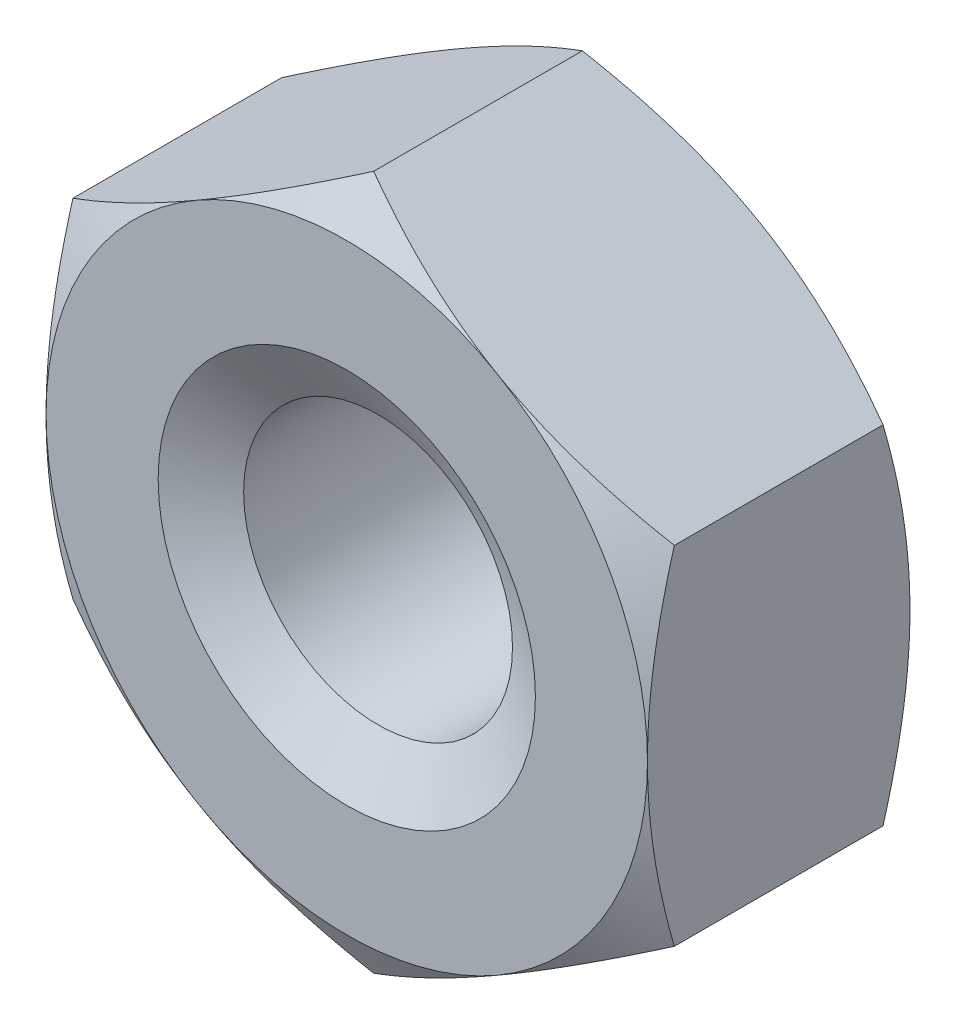
from build123d import *

# Parameters (mm, degrees)
SKETCH_3_R          = 1.229375
EXTRUDE_1_DEPTH     = 2.4
SKETCH_5_R          = 4.5075
SKETCH_5_R_2        = 2.75
CUT_EXTRUDE_1_DEPTH = 0.48
CUT_EXTRUDE_1_DRAFT = -60
SKETCH_7_R          = 4.5075
SKETCH_7_R_2        = 2.75
CUT_EXTRUDE_2_DEPTH = 0.48
CUT_EXTRUDE_2_DRAFT = -60


with BuildPart() as part:
    # 草图3 → 凸台-拉伸1 (new body)
    with BuildSketch(Plane.XY):
        Polygon((0, 3.175426481), (-2.75, 1.58771324), (-2.75, -1.58771324), (0, -3.175426481), (2.75, -1.58771324), (2.75, 1.58771324), align=None)
        Circle(SKETCH_3_R, mode=Mode.SUBTRACT)
    extrude(amount=-EXTRUDE_1_DEPTH)

    # 草图4 → 切除-旋转1 (revolve, cut)
    with BuildSketch(Plane(origin=(0, 0, 0), x_dir=(0, 0, -1), z_dir=(1, 0, 0)), mode=Mode.PRIVATE) as cut_revolve_1_sk:
        Polygon((0, 1.725), (0.286149227, 1.229375), (0.286149227, 0), (0, 0), align=None)
        Polygon((2.4, 0), (2.4, 1.725), (2.113850773, 1.229375), (2.113850773, 0), align=None)
    revolve(cut_revolve_1_sk.sketch.rotate(Axis((0, 0, 0), (0, 0, -1)), 90), axis=Axis((0, 0, 0), (0, 0, -1)), mode=Mode.SUBTRACT)


with BuildPart() as cut_extrude_1_tool:
    # 草图5 → 切除-拉伸1 (with draft: the straight prism first)
    with BuildSketch(Plane.XY):
        Circle(SKETCH_5_R)
        Circle(SKETCH_5_R_2, mode=Mode.SUBTRACT)
    extrude(amount=-CUT_EXTRUDE_1_DEPTH)
    # 切除-拉伸1: the draft: its side faces are tilted about the plane it starts from
    cut_extrude_1_sides = [cut_extrude_1_tool.faces().sort_by_distance(p)[0] for p in [
        (-4.5075, 0, -0.24),
        (-2.75, 0, -0.24),
    ]]
    draft(cut_extrude_1_sides, Plane.XY, CUT_EXTRUDE_1_DRAFT)


with BuildPart() as part_1:
    add(part.part)

    # 切除-拉伸1: cut by cut_extrude_1_tool
    add(cut_extrude_1_tool.part, mode=Mode.SUBTRACT)


with BuildPart() as cut_extrude_2_tool:
    # 草图7 → 切除-拉伸2 (with draft: the straight prism first)
    with BuildSketch(Plane(origin=(0, 0, -2.4), x_dir=(-1, 0, 0), z_dir=(0, 0, -1))):
        Circle(SKETCH_7_R)
        Circle(SKETCH_7_R_2, mode=Mode.SUBTRACT)
    extrude(amount=-CUT_EXTRUDE_2_DEPTH)
    # 切除-拉伸2: the draft: its side faces are tilted about the plane it starts from
    cut_extrude_2_sides = [cut_extrude_2_tool.faces().sort_by_distance(p)[0] for p in [
        (4.5075, 0, -2.16),
        (2.75, 0, -2.16),
    ]]
    draft(cut_extrude_2_sides, Plane(origin=(0, 0, -2.4), x_dir=(-1, 0, 0), z_dir=(0, 0, -1)), CUT_EXTRUDE_2_DRAFT)


with BuildPart() as part_2:
    add(part_1.part)

    # 切除-拉伸2: cut by cut_extrude_2_tool
    add(cut_extrude_2_tool.part, mode=Mode.SUBTRACT)


solid = part_2.part
